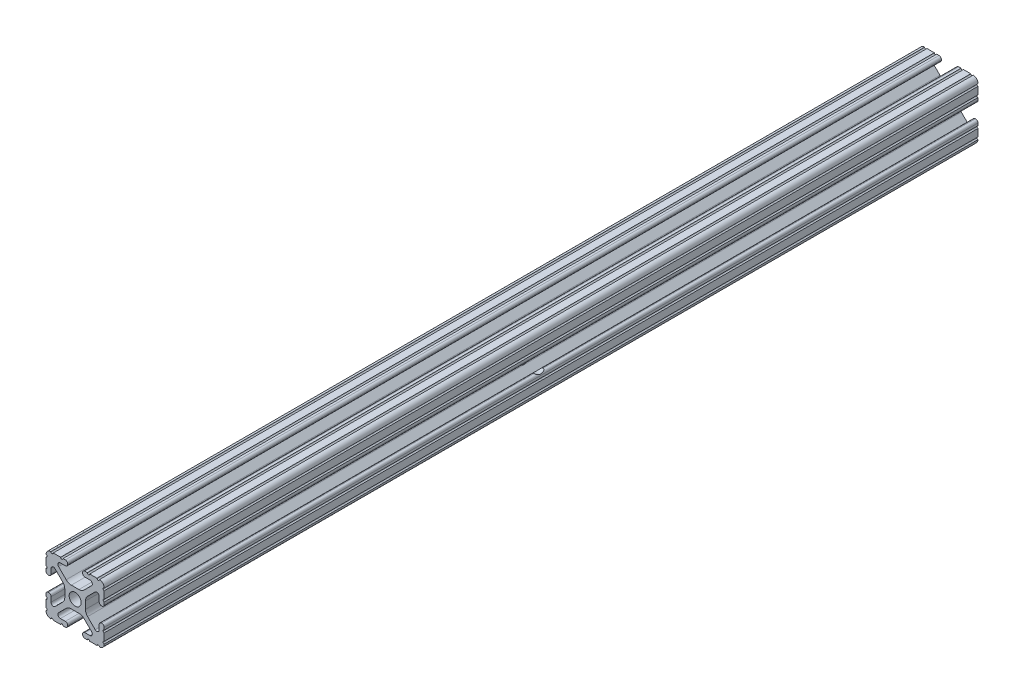
from build123d import *

# Parameters (mm, degrees)
SKETCH1_R           = 2.6035
BOSS_EXTRUDE1_DEPTH = 190.5
SKETCH2_R           = 3.81
CUT_EXTRUDE1_DEPTH  = 25.4


with BuildPart() as part:
    # Sketch1 → Boss-Extrude1 (new, symmetric)
    with BuildSketch(Plane.XY):
        with BuildLine():
            Line((-7.179650497, -8.645192506), (-3.952270251, -5.423690499))
            ThreePointArc((-3.952270251, -5.423690499), (-2.922936451, -4.736929036), (-1.709253557, -4.4958))
            Line((-1.709253557, -4.4958), (1.709253557, -4.4958))
            ThreePointArc((1.709253557, -4.4958), (2.922936451, -4.736929036), (3.952270251, -5.423690499))
            Line((3.952270251, -5.423690499), (7.179650497, -8.645192506))
            ThreePointArc((7.179650497, -8.645192506), (7.41473083, -9.822813117), (6.416408329, -10.4902))
            Line((6.416408329, -10.4902), (4.287512407, -10.4902))
            ThreePointArc((4.287512407, -10.4902), (3.54574862, -10.79744862), (3.2385, -11.539212407))
            Line((3.2385, -11.539212407), (3.2385, -11.650987593))
            ThreePointArc((3.2385, -11.650987593), (3.54574862, -12.39275138), (4.287512407, -12.7))
            Line((4.287512407, -12.7), (5.317126718, -12.7))
            ThreePointArc((5.317126718, -12.7), (5.825126718, -12.192), (6.333126718, -12.7))
            Line((6.333126718, -12.7), (9.550443118, -12.7))
            ThreePointArc((9.550443118, -12.7), (10.058366869, -12.192000006), (10.566443095, -12.699847501))
            ThreePointArc((10.566443095, -12.699847501), (12.082537762, -12.08250727), (12.699846982, -10.566399977))
            ThreePointArc((12.699846982, -10.566399977), (12.192000006, -10.058323491), (12.7, -9.5504))
            Line((12.7, -9.5504), (12.7, -6.3330836))
            ThreePointArc((12.7, -6.3330836), (12.192, -5.8250836), (12.7, -5.3170836))
            Line((12.7, -5.3170836), (12.7, -4.287469289))
            ThreePointArc((12.7, -4.287469289), (12.39275138, -3.545705502), (11.650987593, -3.238456882))
            Line((11.650987593, -3.238456882), (11.539212407, -3.238456882))
            ThreePointArc((11.539212407, -3.238456882), (10.79744862, -3.545705502), (10.4902, -4.287469289))
            Line((10.4902, -4.287469289), (10.4902, -6.402089023))
            ThreePointArc((10.4902, -6.402089023), (9.856505071, -7.351067942), (8.737131347, -7.129408934))
            Line((8.737131347, -7.129408934), (5.441005833, -3.840816462))
            ThreePointArc((5.441005833, -3.840816462), (4.750877967, -2.809883091), (4.5085, -1.593185507))
            Line((4.5085, -1.593185507), (4.5085, 1.593185507))
            ThreePointArc((4.5085, 1.593185507), (4.750877967, 2.809883091), (5.441005833, 3.840816462))
            Line((5.441005833, 3.840816462), (8.737131347, 7.129408934))
            ThreePointArc((8.737131347, 7.129408934), (9.856505071, 7.351067942), (10.4902, 6.402089023))
            Line((10.4902, 6.402089023), (10.4902, 4.287469289))
            ThreePointArc((10.4902, 4.287469289), (10.79744862, 3.545705502), (11.539212407, 3.238456882))
            Line((11.539212407, 3.238456882), (11.650987593, 3.238456882))
            ThreePointArc((11.650987593, 3.238456882), (12.39275138, 3.545705502), (12.7, 4.287469289))
            Line((12.7, 4.287469289), (12.7, 5.3170836))
            ThreePointArc((12.7, 5.3170836), (12.192, 5.8250836), (12.7, 6.3330836))
            Line((12.7, 6.3330836), (12.7, 9.5504))
            ThreePointArc((12.7, 9.5504), (12.192000006, 10.058323491), (12.699846982, 10.566399977))
            ThreePointArc((12.699846982, 10.566399977), (12.082537762, 12.08250727), (10.566443095, 12.699847501))
            ThreePointArc((10.566443095, 12.699847501), (10.058366869, 12.192000006), (9.550443118, 12.7))
            Line((9.550443118, 12.7), (6.333126718, 12.7))
            ThreePointArc((6.333126718, 12.7), (5.825126718, 12.192), (5.317126718, 12.7))
            Line((5.317126718, 12.7), (4.287512407, 12.7))
            ThreePointArc((4.287512407, 12.7), (3.54574862, 12.39275138), (3.2385, 11.650987593))
            Line((3.2385, 11.650987593), (3.2385, 11.539212407))
            ThreePointArc((3.2385, 11.539212407), (3.54574862, 10.79744862), (4.287512407, 10.4902))
            Line((4.287512407, 10.4902), (6.476788598, 10.4902))
            ThreePointArc((6.476788598, 10.4902), (7.432222385, 9.85140422), (7.207036008, 8.724370562))
            Line((7.207036008, 8.724370562), (3.898272566, 5.423169045))
            ThreePointArc((3.898272566, 5.423169045), (2.869120213, 4.736787962), (1.655778399, 4.4958))
            Line((1.655778399, 4.4958), (-1.655778399, 4.4958))
            ThreePointArc((-1.655778399, 4.4958), (-2.869120213, 4.736787962), (-3.898272566, 5.423169045))
            Line((-3.898272566, 5.423169045), (-7.207036008, 8.724370562))
            ThreePointArc((-7.207036008, 8.724370562), (-7.432222385, 9.85140422), (-6.476788598, 10.4902))
            Line((-6.476788598, 10.4902), (-4.287512407, 10.4902))
            ThreePointArc((-4.287512407, 10.4902), (-3.54574862, 10.79744862), (-3.2385, 11.539212407))
            Line((-3.2385, 11.539212407), (-3.2385, 11.650987593))
            ThreePointArc((-3.2385, 11.650987593), (-3.54574862, 12.39275138), (-4.287512407, 12.7))
            Line((-4.287512407, 12.7), (-5.317126718, 12.7))
            ThreePointArc((-5.317126718, 12.7), (-5.825126718, 12.192), (-6.333126718, 12.7))
            Line((-6.333126718, 12.7), (-9.550443118, 12.7))
            ThreePointArc((-9.550443118, 12.7), (-10.058366869, 12.192000006), (-10.566443095, 12.699847501))
            ThreePointArc((-10.566443095, 12.699847501), (-12.082537762, 12.08250727), (-12.699846982, 10.566399977))
            ThreePointArc((-12.699846982, 10.566399977), (-12.192000006, 10.058323491), (-12.7, 9.5504))
            Line((-12.7, 9.5504), (-12.7, 6.3330836))
            ThreePointArc((-12.7, 6.3330836), (-12.192, 5.8250836), (-12.7, 5.3170836))
            Line((-12.7, 5.3170836), (-12.7, 4.287469289))
            ThreePointArc((-12.7, 4.287469289), (-12.39275138, 3.545705502), (-11.650987593, 3.238456882))
            Line((-11.650987593, 3.238456882), (-11.539212407, 3.238456882))
            ThreePointArc((-11.539212407, 3.238456882), (-10.79744862, 3.545705502), (-10.4902, 4.287469289))
            Line((-10.4902, 4.287469289), (-10.4902, 6.402089023))
            ThreePointArc((-10.4902, 6.402089023), (-9.856505071, 7.351067942), (-8.737131347, 7.129408934))
            Line((-8.737131347, 7.129408934), (-5.441005833, 3.840816462))
            ThreePointArc((-5.441005833, 3.840816462), (-4.750877967, 2.809883091), (-4.5085, 1.593185507))
            Line((-4.5085, 1.593185507), (-4.5085, -1.593185507))
            ThreePointArc((-4.5085, -1.593185507), (-4.750877967, -2.809883091), (-5.441005833, -3.840816462))
            Line((-5.441005833, -3.840816462), (-8.737131347, -7.129408934))
            ThreePointArc((-8.737131347, -7.129408934), (-9.856505071, -7.351067942), (-10.4902, -6.402089023))
            Line((-10.4902, -6.402089023), (-10.4902, -4.287469289))
            ThreePointArc((-10.4902, -4.287469289), (-10.79744862, -3.545705502), (-11.539212407, -3.238456882))
            Line((-11.539212407, -3.238456882), (-11.650987593, -3.238456882))
            ThreePointArc((-11.650987593, -3.238456882), (-12.39275138, -3.545705502), (-12.7, -4.287469289))
            Line((-12.7, -4.287469289), (-12.7, -5.3170836))
            ThreePointArc((-12.7, -5.3170836), (-12.192, -5.8250836), (-12.7, -6.3330836))
            Line((-12.7, -6.3330836), (-12.7, -9.5504))
            ThreePointArc((-12.7, -9.5504), (-12.192000006, -10.058323491), (-12.699846982, -10.566399977))
            ThreePointArc((-12.699846982, -10.566399977), (-12.082537762, -12.08250727), (-10.566443095, -12.699847501))
            ThreePointArc((-10.566443095, -12.699847501), (-10.058366869, -12.192000006), (-9.550443118, -12.7))
            Line((-9.550443118, -12.7), (-6.333126718, -12.7))
            ThreePointArc((-6.333126718, -12.7), (-5.825126718, -12.192), (-5.317126718, -12.7))
            Line((-5.317126718, -12.7), (-4.287512407, -12.7))
            ThreePointArc((-4.287512407, -12.7), (-3.54574862, -12.39275138), (-3.2385, -11.650987593))
            Line((-3.2385, -11.650987593), (-3.2385, -11.539212407))
            ThreePointArc((-3.2385, -11.539212407), (-3.54574862, -10.79744862), (-4.287512407, -10.4902))
            Line((-4.287512407, -10.4902), (-6.416408329, -10.4902))
            ThreePointArc((-6.416408329, -10.4902), (-7.41473083, -9.822813117), (-7.179650497, -8.645192506))
        make_face()
        Circle(SKETCH1_R, mode=Mode.SUBTRACT)
    extrude(amount=BOSS_EXTRUDE1_DEPTH, both=True)

    # Sketch2 → Cut-Extrude1 (cut)
    with BuildSketch(Plane.ZY.offset(12.7)):
        with Locations(Location((0, 0, 0), (0, 0, 24.718407228))):
            Circle(SKETCH2_R)
    extrude(amount=-CUT_EXTRUDE1_DEPTH, mode=Mode.SUBTRACT)


solid = part.part
